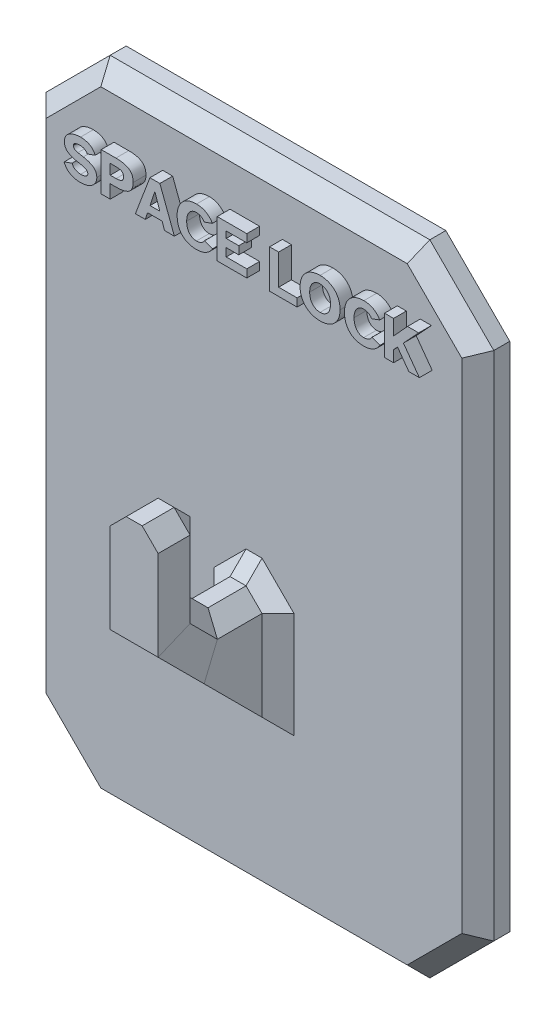
from build123d import *

# Parameters (mm, degrees)
SKETCH1_W               = 70
SKETCH1_H               = 100
BOSS_EXTRUDE1_DEPTH     = 5
SKETCH2_W               = 7.5
SKETCH2_H               = 7.5
CUT_EXTRUDE1_DEPTH      = 64.847963946
CUT_EXTRUDE1_DEPTH_BACK = 64.847963946
BOSS_EXTRUDE2_DEPTH     = 7.5
BOSS_EXTRUDE3_DEPTH     = 2
CHAMFER1_SIZE           = 2.5


with BuildPart() as part:
    # Sketch1 → Boss-Extrude1 (new body)
    with BuildSketch(Plane.XY):
        Rectangle(SKETCH1_W, SKETCH1_H)
    extrude(amount=BOSS_EXTRUDE1_DEPTH)

    # Sweep1: sweep along a path in Sketch3
    with BuildLine(Plane(origin=(0, 0, 0), x_dir=(0, 0, -1), z_dir=(1, 0, 0))) as sweep1_path:
        Line((-5, -10), (-15, -10))
        Line((-15, -10), (-20, -5))
        Line((-20, -5), (-20, 10))
    # Sketch2 → Sweep1 (sweep)
    with BuildSketch(Plane.XY.offset(5)):
        with Locations((0, -10)):
            Rectangle(SKETCH2_W, SKETCH2_H)
    sweep(path=sweep1_path.line, transition=Transition.RIGHT)

    # Sketch4 → Cut-Extrude1 (cut, two sides: drawn at the far end of the back side and taken through both)
    with BuildSketch(Plane.XY.offset(5).offset(-CUT_EXTRUDE1_DEPTH_BACK)):
        Polygon((-25, 50), (-35, 40), (-35, 50), align=None)
        Polygon((25, 50), (35, 50), (35, 40), align=None)
        Polygon((25, -50), (35, -40), (35, -50), align=None)
        Polygon((-25, -50), (-35, -50), (-35, -40), align=None)
    extrude(amount=CUT_EXTRUDE1_DEPTH + CUT_EXTRUDE1_DEPTH_BACK, mode=Mode.SUBTRACT)

    # Sketch6 → Boss-Extrude2 (add)
    with BuildSketch(Plane.ZY.offset(3.75)):
        Polygon((16.553300859, -13.75), (5, -25.303300859), (5, -13.75), align=None)
    extrude(amount=-BOSS_EXTRUDE2_DEPTH)

    # Sketch7 → Boss-Extrude3 (add)
    # profile 1 of 9: a face of its own
    with BuildSketch(Plane.XY.offset(5)):
        with BuildLine():
            add(Edge.make_bspline(
                [(-27.703562403, 36.446483558), (-27.680366242, 36.387224019), (-27.634432018, 36.269875255), (-27.547407394, 36.104117104), (-27.448637736, 35.948832131), (-27.338883259, 35.803405286), (-27.216936376, 35.668229648), (-27.082595077, 35.543914324), (-26.937707214, 35.42791735), (-26.778560024, 35.325171859), (-26.608772111, 35.232341059), (-26.42807614, 35.151012321), (-26.236035188, 35.083156364), (-26.032950818, 35.027150303), (-25.818691526, 34.982585162), (-25.592925543, 34.952021876), (-25.356528625, 34.931596368), (-25.195035657, 34.929300858), (-25.112667291, 34.92813005)],
                knots=[0, 0, 0, 0, 0.949822928, 1.880887868, 2.790433018, 3.695968056, 4.598718229, 5.505467496, 6.426938282, 7.366981965, 8.330567335, 9.314727793, 10.322931966, 11.369322437, 12.458864257, 13.588602051, 14.770083254, 16, 16, 16, 16], degree=3))
            add(Edge.make_bspline(
                [(-25.112667291, 34.92813005), (-25.031148026, 34.930014266), (-24.870347078, 34.93373098), (-24.63285033, 34.959426559), (-24.403011384, 34.999233793), (-24.180851614, 35.056155767), (-23.966137974, 35.12702698), (-23.760465413, 35.217557082), (-23.560755618, 35.320121853), (-23.371438886, 35.439835346), (-23.195104576, 35.572055423), (-23.040729415, 35.721669551), (-22.907148364, 35.883874785), (-22.798717532, 36.062366542), (-22.710001895, 36.253168979), (-22.644766258, 36.458148767), (-22.602659096, 36.67714607), (-22.592150713, 36.827930752), (-22.586765227, 36.905207041)],
                knots=[0, 0, 0, 0, 1.096194071, 2.162299256, 3.209159817, 4.230687145, 5.243967987, 6.246216442, 7.249696708, 8.260587234, 9.255292063, 10.208132732, 11.144975225, 12.073299537, 13.008987527, 13.968610577, 14.958924515, 16, 16, 16, 16], degree=3))
            add(Edge.make_bspline(
                [(-22.586765227, 36.905207041), (-22.591733691, 36.97682296), (-22.6013468, 37.115387258), (-22.640924355, 37.3141056), (-22.699727396, 37.495690978), (-22.776728454, 37.661153697), (-22.874851044, 37.809177777), (-22.991523205, 37.941233026), (-23.12957585, 38.054387649), (-23.33785527, 38.181844745), (-23.62000953, 38.31342316), (-23.972734682, 38.447591766), (-24.341833964, 38.552140604), (-24.595175965, 38.59696787), (-24.723262834, 38.619632032)],
                knots=[0, 0, 0, 0, 0.855979457, 1.656170762, 2.410624222, 3.129072287, 3.826803073, 4.52261459, 5.224052628, 5.948007271, 7.431171957, 8.931352127, 10.448526112, 12, 12, 12, 12], degree=3))
            Line((-24.723262834, 38.619632032), (-25.558674438, 38.779449516))
            add(Edge.make_bspline(
                [(-25.558674438, 38.779449516), (-25.610704328, 38.790258841), (-25.709860192, 38.81085869), (-25.847674386, 38.860303396), (-25.968950636, 38.919921907), (-26.072898516, 38.991203586), (-26.157455137, 39.074135391), (-26.218122658, 39.167849294), (-26.257821767, 39.270874225), (-26.26270517, 39.343198562), (-26.265199946, 39.380146777)],
                knots=[0, 0, 0, 0, 1.265124328, 2.411008287, 3.478761058, 4.478010745, 5.402886555, 6.281086452, 7.121861458, 8, 8, 8, 8], degree=3))
            add(Edge.make_bspline(
                [(-26.265199946, 39.380146777), (-26.260679677, 39.423398178), (-26.251781196, 39.508541723), (-26.195469215, 39.626946124), (-26.102364415, 39.725180492), (-25.979227686, 39.804507239), (-25.830950697, 39.86777082), (-25.66132435, 39.911936807), (-25.472630829, 39.941926878), (-25.340167456, 39.944573141), (-25.270781182, 39.945959293)],
                knots=[0, 0, 0, 0, 0.821490177, 1.617163475, 2.436902161, 3.36159456, 4.380553555, 5.486356093, 6.683316139, 8, 8, 8, 8], degree=3))
            add(Edge.make_bspline(
                [(-25.270781182, 39.945959293), (-25.199674885, 39.94400107), (-25.06287882, 39.940233792), (-24.865753956, 39.910120251), (-24.68635297, 39.85923433), (-24.523727925, 39.790567647), (-24.38139298, 39.70157112), (-24.260932157, 39.593945515), (-24.159348422, 39.470353411), (-24.113771218, 39.374743685), (-24.090807274, 39.326570996)],
                knots=[0, 0, 0, 0, 1.206446071, 2.320991017, 3.374016527, 4.364129792, 5.30760773, 6.208232905, 7.097223225, 8, 8, 8, 8], degree=3))
            Line((-24.090807274, 39.326570996), (-22.838038243, 39.786866634))
            add(Edge.make_bspline(
                [(-22.838038243, 39.786866634), (-22.863144845, 39.842521279), (-22.912811505, 39.952619026), (-23.001810351, 40.107540177), (-23.100677093, 40.251206279), (-23.208585913, 40.384176764), (-23.329836114, 40.502737648), (-23.459648526, 40.610906017), (-23.600212047, 40.706527728), (-23.750463104, 40.789991508), (-23.908656967, 40.860681476), (-24.071194817, 40.923970253), (-24.238246543, 40.977508029), (-24.41016434, 41.020958779), (-24.586644693, 41.052990131), (-24.767560461, 41.07702059), (-24.95305276, 41.089918727), (-25.078238719, 41.09127424), (-25.141415271, 41.091958316)],
                knots=[0, 0, 0, 0, 1.038550422, 2.054492718, 3.035239527, 4.004263392, 4.96345643, 5.916327575, 6.876465306, 7.85201618, 8.837234673, 9.822843472, 10.819125795, 11.820496486, 12.83819495, 13.869781877, 14.924960612, 16, 16, 16, 16], degree=3))
            add(Edge.make_bspline(
                [(-25.141415271, 41.091958316), (-25.221157454, 41.090672718), (-25.378708951, 41.088132685), (-25.612404652, 41.068819743), (-25.839143374, 41.032896608), (-26.060070142, 40.985456557), (-26.2730923, 40.920400521), (-26.480400752, 40.843727077), (-26.680735834, 40.751713039), (-26.872938197, 40.647206615), (-27.052959169, 40.528995211), (-27.21005574, 40.390455152), (-27.347360494, 40.238242877), (-27.457917941, 40.067421725), (-27.550172295, 39.883120194), (-27.615463845, 39.681655458), (-27.661275828, 39.465210712), (-27.672164159, 39.315043031), (-27.677771147, 39.237713603)],
                knots=[0, 0, 0, 0, 1.091971955, 2.157475622, 3.207777688, 4.233885157, 5.249134225, 6.255141963, 7.258741878, 8.265103221, 9.2494454, 10.200551205, 11.12586979, 12.047354577, 12.978346489, 13.940331993, 14.939365989, 16, 16, 16, 16], degree=3))
            add(Edge.make_bspline(
                [(-27.677771147, 39.237713603), (-27.674483464, 39.177075774), (-27.668089139, 39.059139224), (-27.640922581, 38.887641152), (-27.596197371, 38.727947479), (-27.53734391, 38.579317017), (-27.46389869, 38.441246313), (-27.372557118, 38.315874203), (-27.267953833, 38.199460022), (-27.146295345, 38.097040089), (-27.014888041, 38.003798252), (-26.875100935, 37.918763426), (-26.729176817, 37.839672506), (-26.574467798, 37.771264626), (-26.4134946, 37.708862306), (-26.244016333, 37.657750336), (-26.067894323, 37.610680985), (-25.946539229, 37.588249848), (-25.884942573, 37.576864393)],
                knots=[0, 0, 0, 0, 1.087362008, 2.114846866, 3.103037066, 4.052069747, 4.973699729, 5.896155057, 6.824104862, 7.770278569, 8.738081897, 9.708272694, 10.699661328, 11.708972932, 12.736368908, 13.790179799, 14.878353344, 16, 16, 16, 16], degree=3))
            Line((-25.884942573, 37.576864393), (-25.131040579, 37.436226692))
            add(Edge.make_bspline(
                [(-25.131040579, 37.436226692), (-25.050195223, 37.420598683), (-24.89566591, 37.390727018), (-24.677879498, 37.330830455), (-24.485000488, 37.260433367), (-24.34083032, 37.193284008), (-24.2416793, 37.130834212), (-24.178377426, 37.081091339), (-24.124438546, 37.027172925), (-24.078665776, 36.969538948), (-24.045313624, 36.905589518), (-24.018222084, 36.838990239), (-24.002568557, 36.767380879), (-23.999559602, 36.718414348), (-23.998029702, 36.69351737)],
                knots=[0, 0, 0, 0, 2.021377446, 3.86369832, 5.538627199, 7.059764216, 7.757010692, 8.411785035, 9.031926424, 9.626645139, 10.210493405, 10.796395242, 11.388028496, 12, 12, 12, 12], degree=3))
            add(Edge.make_bspline(
                [(-23.998029702, 36.69351737), (-24.000267664, 36.6659604), (-24.004620743, 36.612359098), (-24.024533312, 36.535569562), (-24.055335364, 36.465536866), (-24.094129197, 36.401159966), (-24.144002185, 36.343256241), (-24.204827248, 36.293085261), (-24.273825201, 36.246576478), (-24.38094933, 36.19706296), (-24.525235489, 36.146080235), (-24.708999381, 36.103836876), (-24.902733269, 36.075980853), (-25.035468396, 36.074756688), (-25.103520207, 36.074129072)],
                knots=[0, 0, 0, 0, 0.708173693, 1.377474814, 2.022947678, 2.664833208, 3.298597612, 3.972359551, 4.681941845, 5.426459858, 6.991870048, 8.598828222, 10.256257394, 12, 12, 12, 12], degree=3))
            add(Edge.make_bspline(
                [(-25.103520207, 36.074129072), (-25.186859002, 36.076566382), (-25.347490804, 36.081264189), (-25.57829193, 36.11911373), (-25.787613801, 36.183038679), (-25.946417707, 36.257250912), (-26.059229301, 36.33135254), (-26.136674582, 36.393004365), (-26.20748509, 36.460918525), (-26.271023711, 36.535944612), (-26.325610755, 36.61895988), (-26.373972439, 36.708178156), (-26.416499921, 36.803597537), (-26.437485812, 36.87098851), (-26.448141637, 36.905207041)],
                knots=[0, 0, 0, 0, 1.753362298, 3.379527436, 4.90478297, 6.348109588, 7.049876173, 7.741388633, 8.428634339, 9.111771191, 9.805891654, 10.515577292, 11.246267529, 12, 12, 12, 12], degree=3))
            Line((-26.448141637, 36.905207041), (-27.703562403, 36.446483558))
        make_face()
    # profile 2 of 9: a face of its own
    with BuildSketch(Plane.XY.offset(5)):
        with BuildLine():
            Line((-20.494696316, 35.005225629), (-20.494696316, 37.095987814))
            Line((-20.494696316, 37.095987814), (-19.609474702, 37.095987814))
            add(Edge.make_bspline(
                [(-19.609474702, 37.095987814), (-19.512949174, 37.094898624), (-19.324376145, 37.092770773), (-19.048479793, 37.107926338), (-18.78575531, 37.13469337), (-18.536399465, 37.176050921), (-18.300713468, 37.23228642), (-18.078833823, 37.301558566), (-17.87017579, 37.383907261), (-17.674882402, 37.479431486), (-17.495369878, 37.593767732), (-17.340298777, 37.735297479), (-17.207431492, 37.899961774), (-17.098976864, 38.088449746), (-17.013911853, 38.300213149), (-16.952057474, 38.53459393), (-16.91086983, 38.792041972), (-16.903644433, 38.971847657), (-16.899892084, 39.065225723)],
                knots=[0, 0, 0, 0, 1.204916498, 2.353934341, 3.447552957, 4.50072552, 5.507144687, 6.470335232, 7.400410051, 8.305130608, 9.181490644, 10.047735884, 10.914032333, 11.813195112, 12.752367202, 13.754944245, 14.834080452, 16, 16, 16, 16], degree=3))
            add(Edge.make_bspline(
                [(-16.899892084, 39.065225723), (-16.903636474, 39.157734338), (-16.910844298, 39.335810307), (-16.952171744, 39.591078854), (-17.014032389, 39.823654079), (-17.098231234, 40.033781069), (-17.208297114, 40.219152595), (-17.340246878, 40.382200137), (-17.495476287, 40.522322036), (-17.6749114, 40.635432785), (-17.870498247, 40.729332623), (-18.078813219, 40.811913022), (-18.300545977, 40.881443573), (-18.536465175, 40.936080644), (-18.785875014, 40.975811632), (-19.048465726, 41.003025732), (-19.324569119, 41.01805999), (-19.513328989, 41.015945068), (-19.610042566, 41.01486146)],
                knots=[0, 0, 0, 0, 1.159335541, 2.231681874, 3.232698059, 4.170289135, 5.058653394, 5.923911943, 6.789704034, 7.666336687, 8.571988794, 9.505503644, 10.472256703, 11.481143997, 12.537323696, 13.634987235, 14.788254905, 16, 16, 16, 16], degree=3))
            Line((-19.610042566, 41.01486146), (-21.905962067, 41.01616691))
            Line((-21.905962067, 41.01616691), (-21.905962067, 35.005225629))
            Line((-21.905962067, 35.005225629), (-20.494696316, 35.005225629))
        make_face()
        with BuildLine():
            Line((-20.494696316, 39.855792622), (-19.56476654, 39.855792622))
            add(Edge.make_bspline(
                [(-19.56476654, 39.855792622), (-19.484841638, 39.855092102), (-19.331626689, 39.853749216), (-19.111644345, 39.828337522), (-18.913001477, 39.780386079), (-18.762571429, 39.722139767), (-18.656991603, 39.661114069), (-18.588957427, 39.605126109), (-18.531007634, 39.538808319), (-18.48215995, 39.462951149), (-18.446019715, 39.376359869), (-18.418564576, 39.281243452), (-18.399973329, 39.176543729), (-18.396556322, 39.103201336), (-18.394787047, 39.065225723)],
                knots=[0, 0, 0, 0, 1.781037572, 3.414224772, 4.923837313, 6.326680743, 6.992801752, 7.634335185, 8.281065082, 8.949094245, 9.636325156, 10.36458847, 11.153207937, 12, 12, 12, 12], degree=3))
            add(Edge.make_bspline(
                [(-18.394787047, 39.065225723), (-18.396520567, 39.026373941), (-18.399851551, 38.95171967), (-18.418798242, 38.844935279), (-18.445761347, 38.747946402), (-18.482170434, 38.659715772), (-18.530976934, 38.58254912), (-18.588910533, 38.514932836), (-18.656906605, 38.457597001), (-18.762442736, 38.39488557), (-18.912595434, 38.333905946), (-19.111710308, 38.285759057), (-19.331670812, 38.255860099), (-19.485365407, 38.256189902), (-19.56561387, 38.256362103)],
                knots=[0, 0, 0, 0, 0.858904102, 1.650396881, 2.391060107, 3.081381858, 3.751946835, 4.400513148, 5.042831016, 5.70833034, 7.106722173, 8.605996457, 10.227891054, 12, 12, 12, 12], degree=3))
            Line((-19.56561387, 38.256362103), (-20.494696316, 38.256362103))
            Line((-20.494696316, 38.256362103), (-20.494696316, 39.855792622))
        make_face(mode=Mode.SUBTRACT)
    # profile 3 of 9: a face of its own
    with BuildSketch(Plane.XY.offset(5)):
        Polygon((-16.553609598, 35.005225629), (-15.012136987, 35.005225629), (-14.653654984, 36.094546672), (-12.359370168, 36.094546672), (-12.000888166, 35.005225629), (-10.459039105, 35.005225629), (-12.726814221, 41.01616691), (-14.286210932, 41.01616691), align=None)
        Polygon((-13.515474626, 39.522495728), (-12.744738321, 37.250672824), (-14.268286832, 37.250672824), align=None, mode=Mode.SUBTRACT)
    # profile 4 of 9: a face of its own
    with BuildSketch(Plane.XY.offset(5)):
        with BuildLine():
            add(Edge.make_bspline(
                [(-7.02715328, 34.921596418), (-6.956690074, 34.922911884), (-6.817563658, 34.925509211), (-6.611739586, 34.944337223), (-6.41237016, 34.974173579), (-6.219146838, 35.015042214), (-6.032069968, 35.065504104), (-5.851251854, 35.128311761), (-5.677381218, 35.203228204), (-5.509837287, 35.287723131), (-5.350883365, 35.383757263), (-5.198650742, 35.486474897), (-5.055938581, 35.599265875), (-4.922209803, 35.720993374), (-4.798222521, 35.851972984), (-4.682544014, 35.990887791), (-4.576558984, 36.138882108), (-4.512819978, 36.242736132), (-4.480764707, 36.294965828)],
                knots=[0, 0, 0, 0, 1.114731516, 2.200987007, 3.267230555, 4.302559281, 5.324033743, 6.330944734, 7.328139711, 8.317469177, 9.297247604, 10.264439228, 11.221263555, 12.172512456, 13.12306213, 14.072486967, 15.030625733, 16, 16, 16, 16], degree=3))
            Line((-4.480764707, 36.294965828), (-5.735543595, 36.75163479))
            add(Edge.make_bspline(
                [(-5.735543595, 36.75163479), (-5.773618935, 36.691217078), (-5.847260392, 36.574363273), (-5.986123919, 36.426425757), (-6.139455212, 36.305352853), (-6.310391239, 36.218282172), (-6.487470673, 36.155644813), (-6.665142114, 36.111001492), (-6.841968137, 36.082748199), (-6.959958496, 36.082227471), (-7.018427309, 36.081969431)],
                knots=[0, 0, 0, 0, 1.124265888, 2.174440921, 3.183250871, 4.191311752, 5.184581575, 6.141144096, 7.078864596, 8, 8, 8, 8], degree=3))
            add(Edge.make_bspline(
                [(-7.018427309, 36.081969431), (-7.072091862, 36.083426635), (-7.177773171, 36.086296301), (-7.332455691, 36.110421906), (-7.479842865, 36.149389291), (-7.61900933, 36.20485259), (-7.751041986, 36.27469725), (-7.875798602, 36.359895089), (-7.992136191, 36.461805898), (-8.10216505, 36.576335651), (-8.202378829, 36.7061931), (-8.287690806, 36.851672752), (-8.361764105, 37.010445938), (-8.422639875, 37.18291333), (-8.471187015, 37.369997803), (-8.505590982, 37.570658461), (-8.528024036, 37.785466285), (-8.532977405, 37.933109348), (-8.535536619, 38.00939082)],
                knots=[0, 0, 0, 0, 0.934364169, 1.840038213, 2.719788101, 3.584888763, 4.443610747, 5.316990073, 6.209925091, 7.132976365, 8.079947799, 9.05978502, 10.06454016, 11.12767488, 12.24106468, 13.427352276, 14.670812229, 16, 16, 16, 16], degree=3))
            add(Edge.make_bspline(
                [(-8.535536619, 38.00939082), (-8.532934088, 38.083926243), (-8.52787029, 38.22895132), (-8.505887238, 38.439475335), (-8.470769092, 38.636970731), (-8.422400265, 38.821278461), (-8.36273605, 38.993505511), (-8.289463886, 39.152565408), (-8.202826091, 39.298143856), (-8.104929408, 39.430564195), (-7.99653703, 39.547772312), (-7.880637088, 39.650762387), (-7.758096939, 39.738976206), (-7.626886429, 39.809912013), (-7.489466645, 39.86654532), (-7.344736061, 39.906917126), (-7.193124025, 39.932601066), (-7.089530033, 39.936255854), (-7.036721478, 39.938118935)],
                knots=[0, 0, 0, 0, 1.30919797, 2.547332886, 3.712933366, 4.827776921, 5.889604948, 6.909284468, 7.896912538, 8.859012154, 9.795324587, 10.694644368, 11.577456046, 12.439891886, 13.307635073, 14.181657699, 15.073073372, 16, 16, 16, 16], degree=3))
            add(Edge.make_bspline(
                [(-7.036721478, 39.938118935), (-6.97516651, 39.937170525), (-6.853020656, 39.935288559), (-6.672579614, 39.903019246), (-6.496218136, 39.853614575), (-6.325415071, 39.783444881), (-6.163222577, 39.691776489), (-6.018233886, 39.571128257), (-5.886603244, 39.428399337), (-5.816710568, 39.316942794), (-5.780957441, 39.259927951)],
                knots=[0, 0, 0, 0, 0.984646415, 1.95387116, 2.925653959, 3.914247462, 4.905127984, 5.89674513, 6.924094153, 8, 8, 8, 8], degree=3))
            Line((-5.780957441, 39.259927951), (-4.516191794, 39.716020116))
            add(Edge.make_bspline(
                [(-4.516191794, 39.716020116), (-4.546362868, 39.768278296), (-4.60614521, 39.87182504), (-4.707812682, 40.018678844), (-4.817197463, 40.157609604), (-4.936889934, 40.28687401), (-5.063915542, 40.409065789), (-5.199807731, 40.523052551), (-5.345727351, 40.6275058), (-5.499285758, 40.72444263), (-5.661608696, 40.810234505), (-5.830525263, 40.886947501), (-6.007438378, 40.950107569), (-6.190301886, 41.004699607), (-6.381066147, 41.044328202), (-6.578158752, 41.074699233), (-6.782886947, 41.092959231), (-6.921694739, 41.096626675), (-6.992292782, 41.098491948)],
                knots=[0, 0, 0, 0, 0.971244069, 1.924467354, 2.873009264, 3.816090622, 4.758545902, 5.709496038, 6.669096502, 7.645944055, 8.631114741, 9.62307713, 10.63031822, 11.653427311, 12.693345176, 13.764576584, 14.86305722, 16, 16, 16, 16], degree=3))
            add(Edge.make_bspline(
                [(-6.992292782, 41.098491948), (-7.106980232, 41.094715326), (-7.331009597, 41.087338109), (-7.657148788, 41.044886793), (-7.964288613, 40.978819989), (-8.252693169, 40.887467585), (-8.521862598, 40.769210955), (-8.77272749, 40.62650349), (-9.00470862, 40.458363864), (-9.214839929, 40.263934363), (-9.404640521, 40.049185487), (-9.568490289, 39.812986516), (-9.709538723, 39.559485711), (-9.824543365, 39.285948235), (-9.914646665, 38.993456343), (-9.978992401, 38.681889602), (-10.022313474, 38.352069761), (-10.028547781, 38.125395653), (-10.031738308, 38.00939082)],
                knots=[0, 0, 0, 0, 1.125201103, 2.197957025, 3.221338869, 4.203792769, 5.160483765, 6.100199762, 7.030129938, 7.964614181, 8.903241419, 9.836170966, 10.7791457, 11.744226424, 12.741703441, 13.776723667, 14.862195594, 16, 16, 16, 16], degree=3))
            add(Edge.make_bspline(
                [(-10.031738308, 38.00939082), (-10.02827438, 37.892549081), (-10.021520788, 37.664743687), (-9.982184637, 37.332901328), (-9.918116432, 37.02041126), (-9.831271915, 36.726988485), (-9.719546091, 36.452809578), (-9.583964384, 36.198028928), (-9.421352877, 35.964091176), (-9.23731024, 35.749174537), (-9.030779636, 35.556680227), (-8.80264754, 35.389293848), (-8.554498715, 35.248292361), (-8.287045925, 35.13102093), (-7.999960917, 35.040147702), (-7.69333544, 34.973808067), (-7.367195288, 34.931084704), (-7.142701767, 34.924812832), (-7.02715328, 34.921596418)],
                knots=[0, 0, 0, 0, 1.150502408, 2.243125248, 3.285225207, 4.287928616, 5.25157168, 6.195575321, 7.123475059, 8.051017943, 8.976536055, 9.896922795, 10.830474245, 11.781059771, 12.767079268, 13.7899854, 14.866634651, 16, 16, 16, 16], degree=3))
        make_face()
    # profile 5 of 9: a face of its own
    with BuildSketch(Plane.XY.offset(5)):
        Polygon((-3.758146303, 35.005226905), (0.868595307, 35.005226905), (0.868595307, 36.249230405), (-2.346880552, 36.249230405), (-2.346880552, 37.514140251), (-0.386885436, 37.514140251), (-0.386885436, 38.758145027), (-2.346880552, 38.758145027), (-2.346880552, 39.772162134), (0.868595307, 39.772162134), (0.868595307, 41.01616691), (-3.758146303, 41.01616691), align=None)
    # profile 6 of 9: a face of its own
    with BuildSketch(Plane.XY.offset(5)):
        Polygon((5.848907212, 36.249230405), (5.848907212, 41.01616691), (4.437641461, 41.01616691), (4.437641461, 35.005226905), (8.739222591, 35.005226905), (8.739222591, 36.249230405), align=None)
    # profile 7 of 9: a face of its own
    with BuildSketch(Plane.XY.offset(5)):
        with BuildLine():
            add(Edge.make_bspline(
                [(9.204579242, 38.010605667), (9.208283549, 37.895512346), (9.21550891, 37.671019388), (9.258927212, 37.34371714), (9.3299698, 37.035179185), (9.424696566, 36.744248213), (9.545820821, 36.471367907), (9.692108294, 36.216670962), (9.866516112, 35.981105419), (10.064665216, 35.764981973), (10.283953977, 35.569785359), (10.52356479, 35.400320539), (10.780889141, 35.256405373), (11.055849974, 35.136207534), (11.34969187, 35.04429384), (11.660611663, 34.976777446), (11.989278033, 34.932306706), (12.214696599, 34.925226487), (12.330269984, 34.921596418)],
                knots=[0, 0, 0, 0, 1.117418647, 2.179558417, 3.199188536, 4.187398945, 5.145287777, 6.092542405, 7.033024244, 7.984798601, 8.934362862, 9.877692351, 10.828113046, 11.79204047, 12.785700478, 13.811729134, 14.878061041, 16, 16, 16, 16], degree=3))
            add(Edge.make_bspline(
                [(12.330269984, 34.921596418), (12.44583997, 34.925251985), (12.671683763, 34.932395596), (13.000821548, 34.976634028), (13.312142538, 35.044324087), (13.606035574, 35.136138846), (13.881167965, 35.256794867), (14.139446913, 35.399840181), (14.3792049, 35.570283175), (14.599851379, 35.764445445), (14.797816198, 35.981553444), (14.973712264, 36.216544294), (15.121159435, 36.47135186), (15.243824574, 36.743965453), (15.338817778, 37.035012936), (15.407371486, 37.344020909), (15.45306275, 37.670510954), (15.461029704, 37.894679704), (15.465106535, 38.00939082)],
                knots=[0, 0, 0, 0, 1.12100519, 2.190638544, 3.215813256, 4.208646258, 5.171771424, 6.125087868, 7.067632242, 8.019571338, 8.970553551, 9.912766419, 10.861352201, 11.820167561, 12.8075555, 13.825399109, 14.887218244, 16, 16, 16, 16], degree=3))
            add(Edge.make_bspline(
                [(15.465106535, 38.00939082), (15.461010261, 38.124100986), (15.452989901, 38.348699434), (15.407445405, 38.675625905), (15.339133915, 38.984761235), (15.243128791, 39.275391705), (15.122013467, 39.548324146), (14.972762845, 39.802476143), (14.798760599, 40.038419438), (14.599363573, 40.254370125), (14.378864272, 40.44840948), (14.13986921, 40.620419625), (13.881113346, 40.763213612), (13.60605076, 40.883971731), (13.312138275, 40.975758043), (13.000822754, 41.043456101), (12.671683439, 41.087692296), (12.44583986, 41.09483622), (12.330269984, 41.098491948)],
                knots=[0, 0, 0, 0, 1.112565281, 2.178363476, 3.19600908, 4.179192906, 5.14167658, 6.086429992, 7.031853699, 7.979539686, 8.931293597, 9.876103672, 10.829234664, 11.792172468, 12.78481233, 13.80978761, 14.879212884, 16, 16, 16, 16], degree=3))
            add(Edge.make_bspline(
                [(12.330269984, 41.098491948), (12.214696709, 41.094861718), (11.989278357, 41.087781185), (11.660610461, 41.043312679), (11.349696138, 40.975788282), (11.055834773, 40.883903071), (10.780943727, 40.763603134), (10.523143689, 40.619937466), (10.284293197, 40.448909019), (10.065150945, 40.253835999), (9.865572591, 40.038864121), (9.693053855, 39.802356436), (9.544972521, 39.548301814), (9.425384107, 39.275112437), (9.329672105, 38.984594116), (9.258767818, 38.675933942), (9.215967407, 38.348554081), (9.207565858, 38.124071397), (9.203273792, 38.00939082)],
                knots=[0, 0, 0, 0, 1.121979928, 2.188350774, 3.214416897, 4.208113189, 5.172075812, 6.122531213, 7.068346814, 8.017945749, 8.966640322, 9.910563306, 10.854192595, 11.815982267, 12.800212459, 13.819879811, 14.886250657, 16, 16, 16, 16], degree=3))
            Line((9.203273792, 38.00939082), (9.204579242, 38.010605667))
        make_face()
        with BuildLine():
            add(Edge.make_bspline(
                [(10.69947548, 38.010605667), (10.702430064, 38.087356449), (10.708168125, 38.236413243), (10.732525152, 38.453310555), (10.773037791, 38.655519291), (10.826514748, 38.843554828), (10.892831749, 39.017282468), (10.974109494, 39.176463261), (11.069889952, 39.321315056), (11.179666871, 39.450667203), (11.300511001, 39.563377538), (11.426036692, 39.664490776), (11.560616121, 39.748311762), (11.701532997, 39.81761009), (11.849074234, 39.871894611), (12.003422581, 39.909347162), (12.164404264, 39.933872274), (12.27442496, 39.936689135), (12.330269984, 39.938118935)],
                knots=[0, 0, 0, 0, 1.299557575, 2.523855532, 3.689030449, 4.785593141, 5.828700529, 6.830896117, 7.80404434, 8.761090539, 9.694452624, 10.597005274, 11.484624622, 12.37141718, 13.250579157, 14.139116257, 15.055440467, 16, 16, 16, 16], degree=3))
            add(Edge.make_bspline(
                [(12.330269984, 39.938118935), (12.386547115, 39.936682132), (12.497428037, 39.933851246), (12.659749375, 39.909421238), (12.815651545, 39.871526124), (12.964655219, 39.818609862), (13.10561211, 39.747532031), (13.241011817, 39.664579433), (13.367764108, 39.563771061), (13.488649924, 39.450610769), (13.59859693, 39.321376653), (13.694008954, 39.176101791), (13.777172861, 39.017671222), (13.843060556, 38.84349693), (13.89668234, 38.655536219), (13.93715057, 38.4533056), (13.961574512, 38.236012506), (13.967270949, 38.086547748), (13.970211573, 38.00939082)],
                knots=[0, 0, 0, 0, 0.94887858, 1.869543307, 2.762372546, 3.652537159, 4.529903529, 5.420916842, 6.326355591, 7.256732825, 8.210718431, 9.180754568, 10.183117194, 11.22288877, 12.315944702, 13.47739344, 14.697776145, 16, 16, 16, 16], degree=3))
            add(Edge.make_bspline(
                [(13.970211573, 38.00939082), (13.967270796, 37.932233994), (13.96157406, 37.782769434), (13.937152212, 37.565474947), (13.896676646, 37.363249206), (13.843080051, 37.175271745), (13.777104939, 37.001155584), (13.6944176, 36.842841907), (13.598155845, 36.698571489), (13.488703314, 36.569442131), (13.367750368, 36.456326432), (13.241015393, 36.355506557), (13.105611175, 36.272556956), (12.964655472, 36.201478336), (12.815651477, 36.148562287), (12.659749393, 36.110667115), (12.497428032, 36.086237123), (12.386547113, 36.083406235), (12.330269984, 36.081969431)],
                knots=[0, 0, 0, 0, 1.302721629, 2.523570824, 3.685463525, 4.778937276, 5.819106303, 6.821852081, 7.78614303, 8.740493296, 9.671226166, 10.577011018, 11.46836492, 12.346066663, 13.23657154, 14.129742062, 15.050758712, 16, 16, 16, 16], degree=3))
            add(Edge.make_bspline(
                [(12.330269984, 36.081969431), (12.274424962, 36.083399232), (12.164404269, 36.086216095), (12.003422563, 36.110741192), (11.849074301, 36.148193799), (11.701532747, 36.20247811), (11.560617063, 36.271777229), (11.426033152, 36.355595238), (11.300524654, 36.456719899), (11.179613437, 36.569385664), (11.070330798, 36.698632932), (10.973704298, 36.842482351), (10.892899859, 37.001544436), (10.82649528, 37.175213805), (10.773043038, 37.363266128), (10.732525432, 37.565470068), (10.708115582, 37.782770777), (10.702417139, 37.932234451), (10.69947548, 38.00939082)],
                knots=[0, 0, 0, 0, 0.94451757, 1.860801073, 2.7492987, 3.628421619, 4.515174781, 5.402754696, 6.30526725, 7.238587871, 8.195591552, 9.162563555, 10.16471462, 11.207775668, 12.304289645, 13.469412799, 14.693656366, 16, 16, 16, 16], degree=3))
            Line((10.69947548, 38.00939082), (10.69947548, 38.010605667))
        make_face(mode=Mode.SUBTRACT)
    # profile 8 of 9: a face of its own
    with BuildSketch(Plane.XY.offset(5)):
        with BuildLine():
            add(Edge.make_bspline(
                [(19.149189272, 34.921596418), (19.219652479, 34.922911884), (19.358778895, 34.925509211), (19.564602967, 34.944337223), (19.763972392, 34.974173579), (19.957195714, 35.015042214), (20.144272585, 35.065504104), (20.325090699, 35.128311761), (20.498961335, 35.203228204), (20.666505265, 35.287723131), (20.825459188, 35.383757263), (20.977691811, 35.486474897), (21.120403972, 35.599265875), (21.25413275, 35.720993374), (21.378120032, 35.851972984), (21.493798539, 35.990887791), (21.599783569, 36.138882108), (21.663522575, 36.242736132), (21.695577846, 36.294965828)],
                knots=[0, 0, 0, 0, 1.114731516, 2.200987007, 3.267230555, 4.302559281, 5.324033743, 6.330944734, 7.328139711, 8.317469177, 9.297247604, 10.264439228, 11.221263555, 12.172512456, 13.12306213, 14.072486967, 15.030625733, 16, 16, 16, 16], degree=3))
            Line((21.695577846, 36.294965828), (20.440798958, 36.75163479))
            add(Edge.make_bspline(
                [(20.440798958, 36.75163479), (20.402723618, 36.691217078), (20.329082161, 36.574363273), (20.190218634, 36.426425757), (20.036887341, 36.305352853), (19.865951314, 36.218282172), (19.688871879, 36.155644813), (19.511200439, 36.111001492), (19.334374416, 36.082748199), (19.216384057, 36.082227471), (19.157915244, 36.081969431)],
                knots=[0, 0, 0, 0, 1.124265888, 2.174440921, 3.183250871, 4.191311752, 5.184581575, 6.141144096, 7.078864596, 8, 8, 8, 8], degree=3))
            add(Edge.make_bspline(
                [(19.157915244, 36.081969431), (19.104250691, 36.083426635), (18.998569381, 36.086296301), (18.843886862, 36.110421906), (18.696499688, 36.149389291), (18.557333223, 36.20485259), (18.425300567, 36.27469725), (18.300543951, 36.359895089), (18.184206362, 36.461805898), (18.074177503, 36.576335651), (17.973963723, 36.7061931), (17.888651747, 36.851672752), (17.814578448, 37.010445938), (17.753702678, 37.18291333), (17.705155538, 37.369997803), (17.670751571, 37.570658461), (17.648318517, 37.785466285), (17.643365148, 37.933109348), (17.640805934, 38.00939082)],
                knots=[0, 0, 0, 0, 0.934364169, 1.840038213, 2.719788101, 3.584888763, 4.443610747, 5.316990073, 6.209925091, 7.132976365, 8.079947799, 9.05978502, 10.06454016, 11.12767488, 12.24106468, 13.427352276, 14.670812229, 16, 16, 16, 16], degree=3))
            add(Edge.make_bspline(
                [(17.640805934, 38.00939082), (17.643408465, 38.083926243), (17.648472263, 38.22895132), (17.670455315, 38.439475335), (17.705573461, 38.636970731), (17.753942288, 38.821278461), (17.813606503, 38.993505511), (17.886878666, 39.152565408), (17.973516462, 39.298143856), (18.071413145, 39.430564195), (18.179805523, 39.547772312), (18.295705465, 39.650762387), (18.418245614, 39.738976206), (18.549456124, 39.809912013), (18.686875908, 39.86654532), (18.831606492, 39.906917126), (18.983218527, 39.932601066), (19.08681252, 39.936255854), (19.139621075, 39.938118935)],
                knots=[0, 0, 0, 0, 1.30919797, 2.547332886, 3.712933366, 4.827776921, 5.889604948, 6.909284468, 7.896912538, 8.859012154, 9.795324587, 10.694644368, 11.577456046, 12.439891886, 13.307635073, 14.181657699, 15.073073372, 16, 16, 16, 16], degree=3))
            add(Edge.make_bspline(
                [(19.139621075, 39.938118935), (19.201176043, 39.937170525), (19.323321897, 39.935288559), (19.503762939, 39.903019246), (19.680124417, 39.853614575), (19.850927482, 39.783444881), (20.013119976, 39.691776489), (20.158108666, 39.571128257), (20.289739309, 39.428399337), (20.359631985, 39.316942794), (20.395385112, 39.259927951)],
                knots=[0, 0, 0, 0, 0.984646415, 1.95387116, 2.925653959, 3.914247462, 4.905127984, 5.89674513, 6.924094153, 8, 8, 8, 8], degree=3))
            Line((20.395385112, 39.259927951), (21.660150758, 39.716020116))
            add(Edge.make_bspline(
                [(21.660150758, 39.716020116), (21.629979685, 39.768278296), (21.570197343, 39.87182504), (21.468529871, 40.018678844), (21.35914509, 40.157609604), (21.239452619, 40.28687401), (21.112427011, 40.409065789), (20.976534822, 40.523052551), (20.830615202, 40.6275058), (20.677056795, 40.72444263), (20.514733857, 40.810234505), (20.34581729, 40.886947501), (20.168904175, 40.950107569), (19.986040667, 41.004699607), (19.795276405, 41.044328202), (19.598183801, 41.074699233), (19.393455606, 41.092959231), (19.254647814, 41.096626675), (19.184049771, 41.098491948)],
                knots=[0, 0, 0, 0, 0.971244069, 1.924467354, 2.873009264, 3.816090622, 4.758545902, 5.709496038, 6.669096502, 7.645944055, 8.631114741, 9.62307713, 10.63031822, 11.653427311, 12.693345176, 13.764576584, 14.86305722, 16, 16, 16, 16], degree=3))
            add(Edge.make_bspline(
                [(19.184049771, 41.098491948), (19.069362321, 41.094715326), (18.845332956, 41.087338109), (18.519193765, 41.044886793), (18.21205394, 40.978819989), (17.923649384, 40.887467585), (17.654479954, 40.769210955), (17.403615063, 40.62650349), (17.171633933, 40.458363864), (16.961502624, 40.263934363), (16.771702032, 40.049185487), (16.607852264, 39.812986516), (16.46680383, 39.559485711), (16.351799187, 39.285948235), (16.261695888, 38.993456343), (16.197350152, 38.681889602), (16.154029079, 38.352069761), (16.147794772, 38.125395653), (16.144604245, 38.00939082)],
                knots=[0, 0, 0, 0, 1.125201103, 2.197957025, 3.221338869, 4.203792769, 5.160483765, 6.100199762, 7.030129938, 7.964614181, 8.903241419, 9.836170966, 10.7791457, 11.744226424, 12.741703441, 13.776723667, 14.862195594, 16, 16, 16, 16], degree=3))
            add(Edge.make_bspline(
                [(16.144604245, 38.00939082), (16.148068173, 37.892549081), (16.154821765, 37.664743687), (16.194157916, 37.332901328), (16.258226121, 37.02041126), (16.345070638, 36.726988485), (16.456796461, 36.452809578), (16.592378169, 36.198028928), (16.754989676, 35.964091176), (16.939032313, 35.749174537), (17.145562917, 35.556680227), (17.373695013, 35.389293848), (17.621843838, 35.248292361), (17.889296628, 35.13102093), (18.176381635, 35.040147702), (18.483007112, 34.973808067), (18.809147265, 34.931084704), (19.033640785, 34.924812832), (19.149189272, 34.921596418)],
                knots=[0, 0, 0, 0, 1.150502408, 2.243125248, 3.285225207, 4.287928616, 5.25157168, 6.195575321, 7.123475059, 8.051017943, 8.976536055, 9.896922795, 10.830474245, 11.781059771, 12.767079268, 13.7899854, 14.866634651, 16, 16, 16, 16], degree=3))
        make_face()
    # profile 9 of 9: a face of its own
    with BuildSketch(Plane.XY.offset(5)):
        Polygon((22.41819625, 41.01616691), (22.41819625, 35.005225629), (23.829462001, 35.005225629), (23.829462001, 36.778039851), (24.443654019, 37.452969123), (26.213972189, 35.005225629), (27.866871296, 35.005225629), (25.364942046, 38.442865389), (27.749452234, 41.01616691), (26.006230771, 41.01616691), (23.829462001, 38.631845585), (23.829462001, 41.01616691), align=None)
    extrude(amount=BOSS_EXTRUDE3_DEPTH)

    # Chamfer1
    chamfer1_edges = [part.edges().sort_by_distance(p)[0] for p in [
        (3.75, 10, 20),
        (0, 10, 16.25),
        (-3.75, 10, 20),
        (3.75, 3.276650429, 16.25),
        (-3.75, 3.276650429, 16.25),
        (-3.75, -4.848349571, 14.848349571),
        (3.75, -4.848349571, 14.848349571),
        (-3.75, -15.776650429, 5),
        (-3.75, -6.25, 9.223349571),
        (0, -6.25, 5),
        (3.75, -6.25, 9.223349571),
        (3.75, -15.776650429, 5),
        (0, -50, 5),
        (-35, 0, 5),
        (0, 50, 5),
        (35, 0, 5),
        (-30, -45, 5),
        (30, -45, 5),
        (30, 45, 5),
        (-30, 45, 5),
    ]]
    chamfer(chamfer1_edges, length=CHAMFER1_SIZE)


solid = part.part
